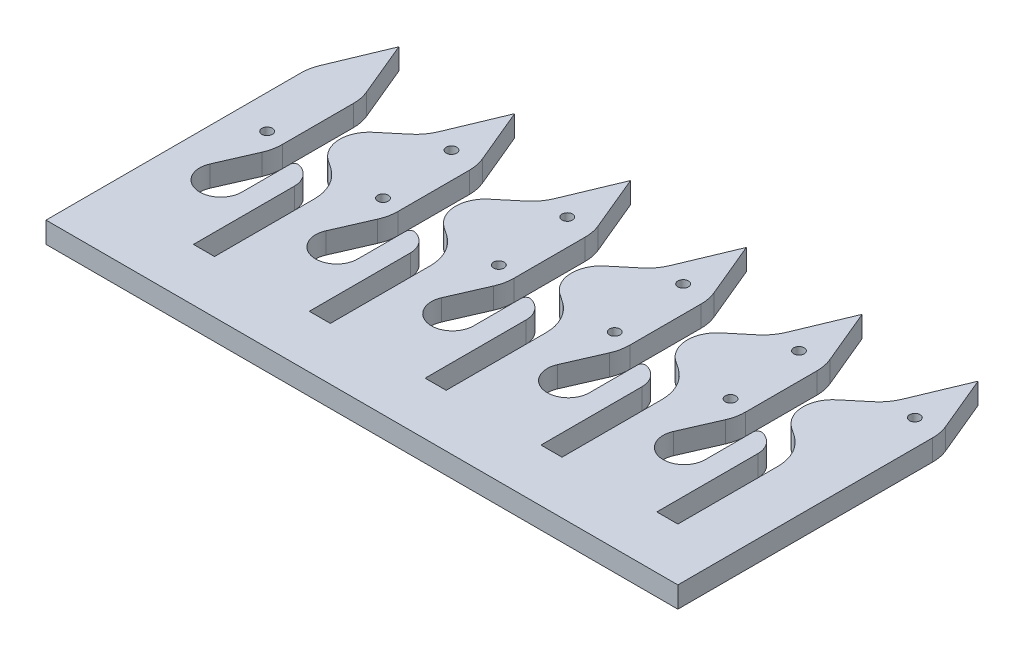
from build123d import *

# Parameters (mm, degrees)
SKETCH1_R           = 2.5
BOSS_EXTRUDE1_DEPTH = 10
FILLET1_R           = 20
FILLET2_R           = 2


with BuildPart() as part:
    # Sketch1 → Boss-Extrude1 (new body)
    with BuildSketch(Plane(origin=(0, 0, 0), x_dir=(1, 0, 0), z_dir=(0, 1, 0))):
        with BuildLine():
            Line((0, 0), (0, 125))
            Line((0, 125), (-12.5, 155))
            Line((-12.5, 155), (-25, 125))
            Line((-25, 125), (-38.474856438, 113.744856999))
            ThreePointArc((-38.474856438, 113.744856999), (-43.483141428, 102.313155182), (-37.378629761, 91.427308304))
            Line((-37.378629761, 91.427308304), (-25, 83))
            Line((-25, 83), (-25, 25))
            Line((-25, 25), (-35, 25))
            Line((-35, 25), (-35, 73))
            ThreePointArc((-35, 73), (-37.928932188, 80.071067812), (-45, 83))
            Line((-45, 83), (-45, 58))
            ThreePointArc((-45, 58), (-57.043096437, 48.210936871), (-64.16515139, 62))
            Line((-64.16515139, 62), (-55, 83))
            Line((-55, 83), (-55, 125))
            Line((-55, 125), (-67.5, 155))
            Line((-67.5, 155), (-80, 125))
            Line((-80, 125), (-93.474856438, 113.744856999))
            ThreePointArc((-93.474856438, 113.744856999), (-98.483141428, 102.313155182), (-92.378629761, 91.427308304))
            Line((-92.378629761, 91.427308304), (-80, 83))
            Line((-80, 83), (-80, 25))
            Line((-80, 25), (-90, 25))
            Line((-90, 25), (-90, 73))
            ThreePointArc((-90, 73), (-92.928932188, 80.071067812), (-100, 83))
            Line((-100, 83), (-100, 58))
            ThreePointArc((-100, 58), (-112.043096437, 48.210936871), (-119.16515139, 62))
            Line((-119.16515139, 62), (-110, 83))
            Line((-110, 83), (-110, 125))
            Line((-110, 125), (-122.5, 155))
            Line((-122.5, 155), (-135, 125))
            Line((-135, 125), (-148.474856438, 113.744856999))
            ThreePointArc((-148.474856438, 113.744856999), (-153.483141428, 102.313155182), (-147.378629761, 91.427308304))
            Line((-147.378629761, 91.427308304), (-135, 83))
            Line((-135, 83), (-135, 25))
            Line((-135, 25), (-145, 25))
            Line((-145, 25), (-145, 73))
            ThreePointArc((-145, 73), (-147.928932188, 80.071067812), (-155, 83))
            Line((-155, 83), (-155, 58))
            ThreePointArc((-155, 58), (-167.043096437, 48.210936871), (-174.16515139, 62))
            Line((-174.16515139, 62), (-165, 83))
            Line((-165, 83), (-165, 125))
            Line((-165, 125), (-177.5, 155))
            Line((-177.5, 155), (-190, 125))
            Line((-190, 125), (-203.474856438, 113.744856999))
            ThreePointArc((-203.474856438, 113.744856999), (-208.483141428, 102.313155182), (-202.378629761, 91.427308304))
            Line((-202.378629761, 91.427308304), (-190, 83))
            Line((-190, 83), (-190, 25))
            Line((-190, 25), (-200, 25))
            Line((-200, 25), (-200, 73))
            ThreePointArc((-200, 73), (-202.928932188, 80.071067812), (-210, 83))
            Line((-210, 83), (-210, 58))
            ThreePointArc((-210, 58), (-222.043096437, 48.210936871), (-229.16515139, 62))
            Line((-229.16515139, 62), (-220, 83))
            Line((-220, 83), (-220, 125))
            Line((-220, 125), (-232.5, 155))
            Line((-232.5, 155), (-245, 125))
            Line((-245, 125), (-258.474856438, 113.744856999))
            ThreePointArc((-258.474856438, 113.744856999), (-263.483141428, 102.313155182), (-257.378629761, 91.427308304))
            Line((-257.378629761, 91.427308304), (-245, 83))
            Line((-245, 83), (-245, 25))
            Line((-245, 25), (-255, 25))
            Line((-255, 25), (-255, 73))
            ThreePointArc((-255, 73), (-257.928932188, 80.071067812), (-265, 83))
            Line((-265, 83), (-265, 58))
            ThreePointArc((-265, 58), (-277.043096437, 48.210936871), (-284.16515139, 62))
            Line((-284.16515139, 62), (-275, 83))
            Line((-275, 83), (-275, 125))
            Line((-275, 125), (-287.5, 155))
            Line((-287.5, 155), (-300, 125))
            Line((-300, 125), (-300, 0))
            Line((-300, 0), (0, 0))
        make_face()
        with Locations(Location((-12.5, 125, 0), (0, 0, 270))):
            Circle(SKETCH1_R, mode=Mode.SUBTRACT)
        with Locations(Location((-64, 89, 0), (0, 0, 270))):
            Circle(SKETCH1_R, mode=Mode.SUBTRACT)
        with Locations(Location((-67.5, 125, 0), (0, 0, 270))):
            Circle(SKETCH1_R, mode=Mode.SUBTRACT)
        with Locations(Location((-119, 89, 0), (0, 0, 270))):
            Circle(SKETCH1_R, mode=Mode.SUBTRACT)
        with Locations(Location((-122.5, 125, 0), (0, 0, 270))):
            Circle(SKETCH1_R, mode=Mode.SUBTRACT)
        with Locations(Location((-174, 89, 0), (0, 0, 270))):
            Circle(SKETCH1_R, mode=Mode.SUBTRACT)
        with Locations(Location((-177.5, 125, 0), (0, 0, 270))):
            Circle(SKETCH1_R, mode=Mode.SUBTRACT)
        with Locations(Location((-229, 89, 0), (0, 0, 270))):
            Circle(SKETCH1_R, mode=Mode.SUBTRACT)
        with Locations(Location((-232.5, 125, 0), (0, 0, 270))):
            Circle(SKETCH1_R, mode=Mode.SUBTRACT)
        with Locations(Location((-284, 89, 0), (0, 0, 270))):
            Circle(SKETCH1_R, mode=Mode.SUBTRACT)
    extrude(amount=BOSS_EXTRUDE1_DEPTH)

    # Fillet1
    fillet1_edges = [part.edges().sort_by_distance(p)[0] for p in [
        (-300, 5, -125),
        (-275, 5, -125),
        (-275, 5, -83),
        (-245, 5, -83),
        (-245, 5, -125),
        (-220, 5, -125),
        (-220, 5, -83),
        (-190, 5, -83),
        (-190, 5, -125),
        (-165, 5, -125),
        (-165, 5, -83),
        (-135, 5, -83),
        (-135, 5, -125),
        (-110, 5, -125),
        (-110, 5, -83),
        (-80, 5, -83),
        (-80, 5, -125),
        (-55, 5, -125),
        (-55, 5, -83),
        (-25, 5, -83),
        (-25, 5, -125),
        (0, 5, -125),
    ]]
    fillet(fillet1_edges, radius=FILLET1_R)

    # Fillet2
    fillet2_edges = [part.edges().sort_by_distance(p)[0] for p in [
        (-265, 5, -83),
        (-210, 5, -83),
        (-155, 5, -83),
        (-100, 5, -83),
        (-45, 5, -83),
    ]]
    fillet(fillet2_edges, radius=FILLET2_R)


solid = part.part
